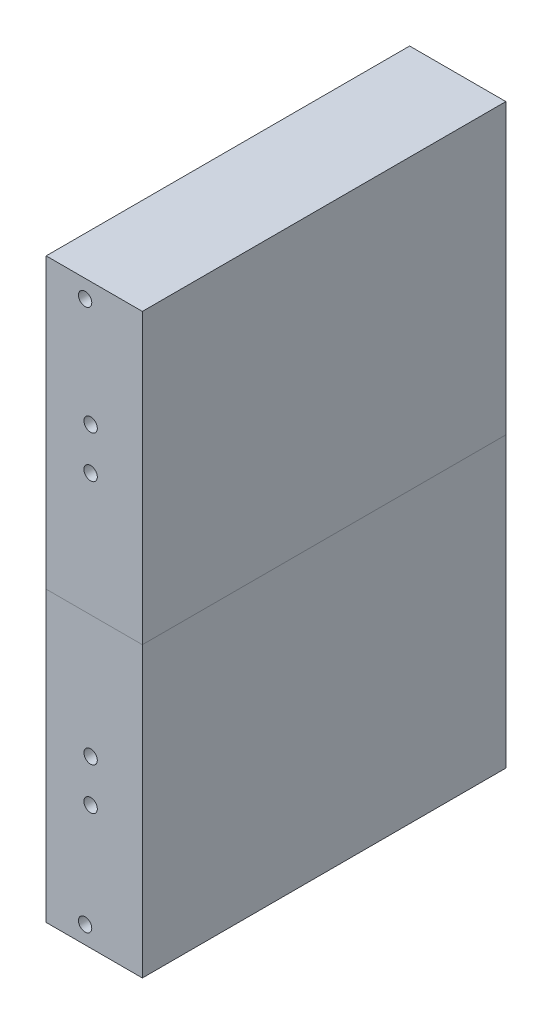
from build123d import *

# Parameters (mm, degrees)
SKETCH1_W           = 57.15
SKETCH1_H           = 171.45
BOSS_EXTRUDE1_DEPTH = 215.9
SKETCH2_R           = 3.175
CUT_EXTRUDE1_DEPTH  = 46.7399878
SKETCH3_R           = 3.96875
CUT_EXTRUDE2_DEPTH  = 13.0400044
SKETCH4_R           = 3.175
CUT_EXTRUDE3_DEPTH  = 35.1600008
SKETCH5_R           = 3.175
CUT_EXTRUDE4_DEPTH  = 94.6600088
SKETCH6_R           = 3.96875
CUT_EXTRUDE5_DEPTH  = 10.16
SKETCH7_R           = 3.96875
CUT_EXTRUDE6_DEPTH  = 69.660008


with BuildPart() as part:
    # Sketch1 → Boss-Extrude1 (new body)
    with BuildSketch(Plane.XY):
        with Locations((28.575, 85.725)):
            Rectangle(SKETCH1_W, SKETCH1_H)
    extrude(amount=BOSS_EXTRUDE1_DEPTH)

    # Sketch2 → Cut-Extrude1 (cut)
    with BuildSketch(Plane(origin=(0, 0, 0), x_dir=(-1, 0, 0), z_dir=(0, 0, -1))):
        with Locations((-24.41, 70.569)):
            Circle(SKETCH2_R)
    extrude(amount=-CUT_EXTRUDE1_DEPTH, mode=Mode.SUBTRACT)

    # Sketch3 → Cut-Extrude2 (cut)
    with BuildSketch(Plane(origin=(0, 0, 0), x_dir=(-1, 0, 0), z_dir=(0, 0, -1))):
        with Locations((-24.41, 70.569)):
            Circle(SKETCH3_R)
    extrude(amount=-CUT_EXTRUDE2_DEPTH, mode=Mode.SUBTRACT)

    # Sketch4 → Cut-Extrude3 (cut)
    with BuildSketch(Plane.XY.offset(215.9)):
        with Locations((26.41, 73.569)):
            Circle(SKETCH4_R)
        with Locations((26.41, 98.569)):
            Circle(SKETCH4_R)
    extrude(amount=-CUT_EXTRUDE3_DEPTH, mode=Mode.SUBTRACT)

    # Sketch5 → Cut-Extrude4 (cut)
    with BuildSketch(Plane.XY.offset(215.9)):
        with Locations((23.13, 10.569)):
            Circle(SKETCH5_R)
    extrude(amount=-CUT_EXTRUDE4_DEPTH, mode=Mode.SUBTRACT)

    # Sketch6 → Cut-Extrude5 (cut)
    with BuildSketch(Plane.XY.offset(215.9)):
        with Locations((26.41, 73.569)):
            Circle(SKETCH6_R)
        with Locations((26.41, 98.569)):
            Circle(SKETCH6_R)
    extrude(amount=-CUT_EXTRUDE5_DEPTH, mode=Mode.SUBTRACT)

    # Sketch7 → Cut-Extrude6 (cut)
    with BuildSketch(Plane.XY.offset(215.9)):
        with Locations((23.13, 10.569)):
            Circle(SKETCH7_R)
    extrude(amount=-CUT_EXTRUDE6_DEPTH, mode=Mode.SUBTRACT)


with BuildPart() as body_2:
    # Mirror2: mirrored copy
    add(part.part.mirror(Plane(origin=(0, 171.45, 215.9), x_dir=(0, 0, 1), z_dir=(0, -1, 0))))


solid = Compound([part.part, body_2.part])
